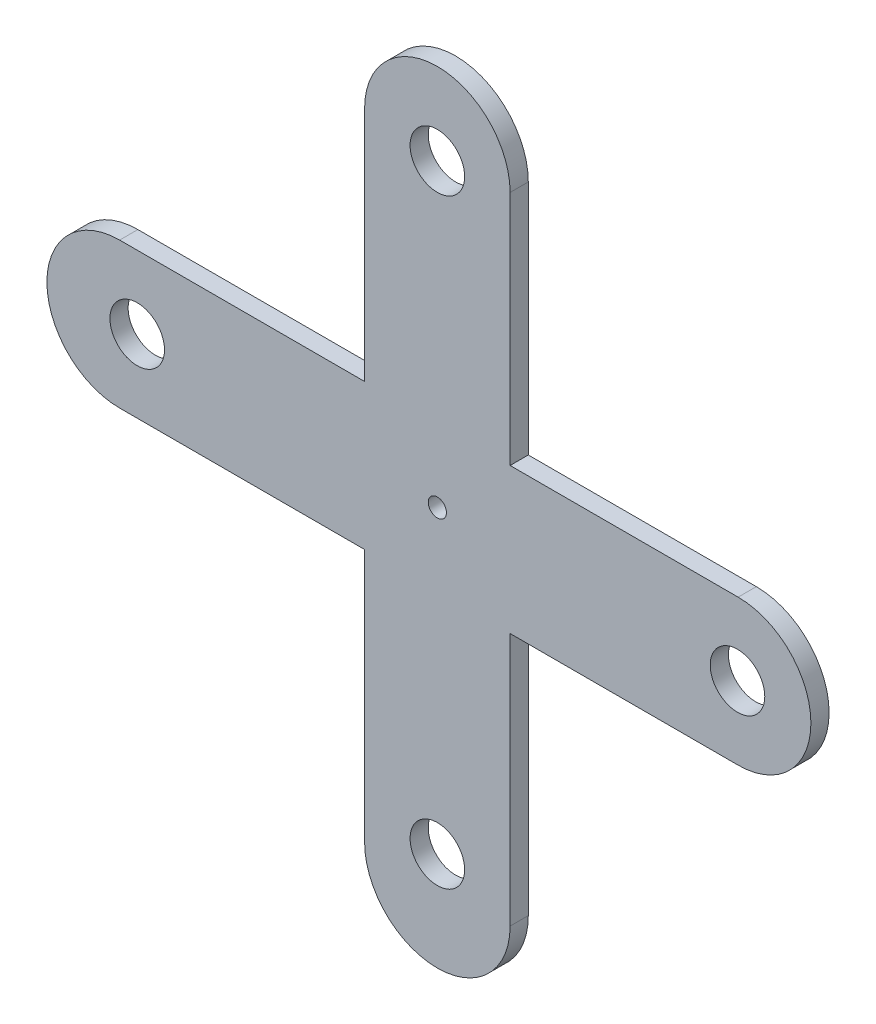
from build123d import *

# Parameters (mm, degrees)
BOSS_EXTRU_1_DEPTH      = 1
ESQUISSE2_R             = 1.5
ESQUISSE2_R_2           = 0.5
ENL_V_MAT_EXTRU_1_DEPTH = 18


with BuildPart() as part:
    # Esquisse1 → Boss.-Extru.1 (new body)
    with BuildSketch(Plane.XY):
        with BuildLine():
            Line((-4, 2.530340064), (-4, 15.530340064))
            ThreePointArc((-4, 15.530340064), (0, 19.530340064), (4, 15.530340064))
            Line((4, 15.530340064), (4, 2.530340064))
            Line((4, 2.530340064), (16.535533906, 2.530340064))
            ThreePointArc((16.535533906, 2.530340064), (20.535533906, -1.469659936), (16.535533906, -5.469659936))
            Line((16.535533906, -5.469659936), (4, -5.469659936))
            Line((4, -5.469659936), (4, -19.398592124))
            ThreePointArc((4, -19.398592124), (0, -23.398592124), (-4, -19.398592124))
            Line((-4, -19.398592124), (-4, -5.469659936))
            Line((-4, -5.469659936), (-17.464466094, -5.469659936))
            ThreePointArc((-17.464466094, -5.469659936), (-21.464466094, -1.469659936), (-17.464466094, 2.530340064))
            Line((-17.464466094, 2.530340064), (-4, 2.530340064))
        make_face()
    extrude(amount=BOSS_EXTRU_1_DEPTH)

    # Esquisse2 → Enlèv. mat.-Extru.1 (cut)
    with BuildSketch(Plane.XY.offset(1)):
        with Locations((0, 15.030340064)):
            Circle(ESQUISSE2_R)
        with Locations((16.5, -1.469659936)):
            Circle(ESQUISSE2_R)
        with Locations((0, -17.969659936)):
            Circle(ESQUISSE2_R)
        with Locations((-16.5, -1.469659936)):
            Circle(ESQUISSE2_R)
        with Locations((0, -1.469659936)):
            Circle(ESQUISSE2_R_2)
    extrude(amount=-ENL_V_MAT_EXTRU_1_DEPTH, mode=Mode.SUBTRACT)


solid = part.part
